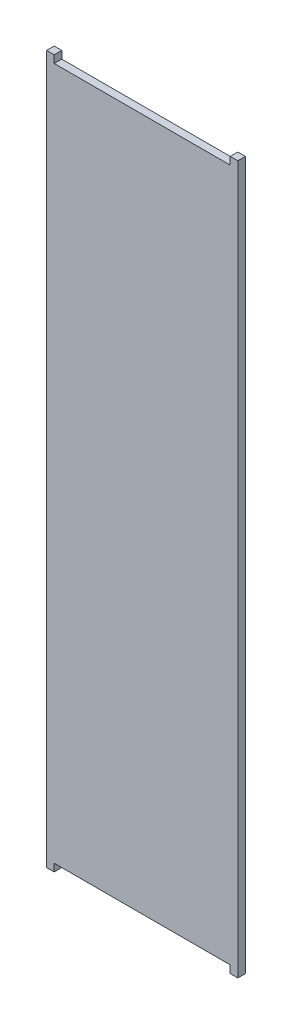
from build123d import *

# Parameters (mm, degrees)
SKETCH1_W           = 41.65
SKETCH1_H           = 154.2
BOSS_EXTRUDE1_DEPTH = 1.65
SKETCH3_W           = 38.35
SKETCH3_H           = 1.65
CUT_EXTRUDE1_DEPTH  = 1.65


with BuildPart() as part:
    # Sketch1 → Boss-Extrude1 (new body)
    with BuildSketch(Plane.XY):
        Rectangle(SKETCH1_W, SKETCH1_H)
    extrude(amount=BOSS_EXTRUDE1_DEPTH)

    # Sketch3 → Cut-Extrude1 (cut)
    with BuildSketch(Plane(origin=(0, 77.1, 0), x_dir=(1, 0, 0), z_dir=(0, 1, 0))):
        with Locations((0, -0.825)):
            Rectangle(SKETCH3_W, SKETCH3_H)
    cut_extrude1 = extrude(amount=-CUT_EXTRUDE1_DEPTH, mode=Mode.SUBTRACT)

    # Mirror1: Cut-Extrude1 across plane
    add(cut_extrude1.mirror(Plane.ZX), mode=Mode.SUBTRACT)


solid = part.part
